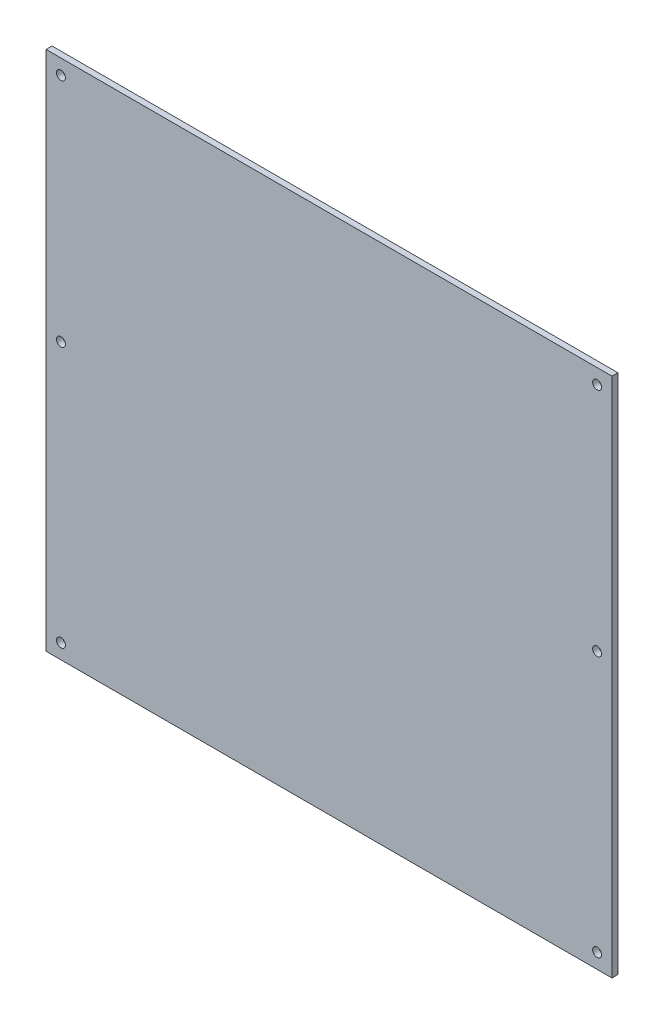
from build123d import *

# Parameters (mm, degrees)
SKICA1_W                = 380
SKICA1_H                = 350
SKICA1_R                = 3
P_IDAT_VYSUNUT_M1_DEPTH = 4


with BuildPart() as part:
    # Skica1 → Přidat vysunutím1 (new body)
    with BuildSketch(Plane.XY):
        Rectangle(SKICA1_W, SKICA1_H)
        with Locations((-180, 165)):
            Circle(SKICA1_R, mode=Mode.SUBTRACT)
        with Locations((180, 165)):
            Circle(SKICA1_R, mode=Mode.SUBTRACT)
        with Locations((180, 10)):
            Circle(SKICA1_R, mode=Mode.SUBTRACT)
        with Locations((180, -165)):
            Circle(SKICA1_R, mode=Mode.SUBTRACT)
        with Locations((-180, 10)):
            Circle(SKICA1_R, mode=Mode.SUBTRACT)
        with Locations((-180, -165)):
            Circle(SKICA1_R, mode=Mode.SUBTRACT)
    extrude(amount=P_IDAT_VYSUNUT_M1_DEPTH)


solid = part.part
